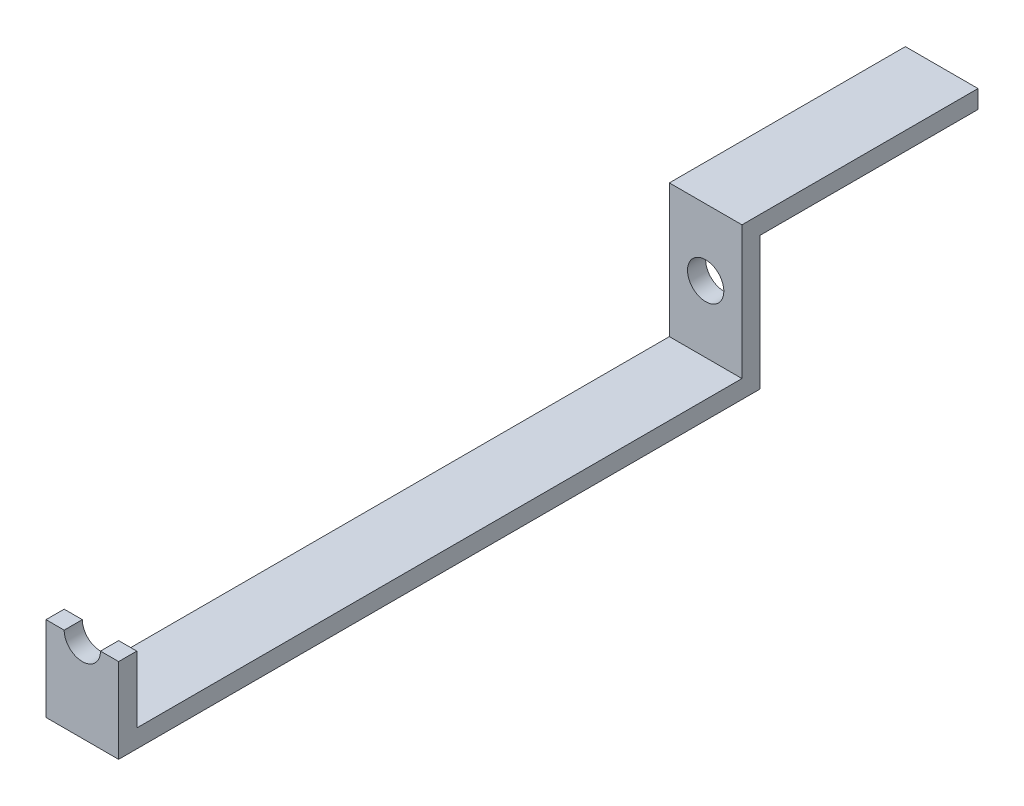
from build123d import *

# Parameters (mm, degrees)
EXTRUDE_1_DEPTH     = 12
CUT_EXTRUDE_1_REACH = 111.567
SKETCH_3_R          = 3


with BuildPart() as part:
    # 草图2 → 凸台-拉伸1 (new body)
    with BuildSketch(Plane(origin=(0, 0, 0), x_dir=(0, 0, -1), z_dir=(1, 0, 0))):
        Polygon((-53, 0), (53, 0), (53, 20), (53, 22), (89, 22), (89, 25), (50, 25), (50, 20), (50, 3), (-50, 3), (-50, 14), (-53, 14), align=None)
    extrude(amount=EXTRUDE_1_DEPTH)

    # 切除-拉伸1: up to this face of the body (flat: up to its plane)
    cut_extrude_1_end = Plane(part.part.faces().sort_by_distance((6, 7, 53))[0])
    # 草图3 → 切除-拉伸1 (cut, up to the picked face)
    with BuildSketch(Plane(origin=(0, 0, -53), x_dir=(-1, 0, 0), z_dir=(0, 0, -1)), mode=Mode.PRIVATE) as cut_extrude_1_sk1:
        with Locations((-6, 14)):
            Circle(SKETCH_3_R)
    cut_extrude_1_tool1 = split(extrude(cut_extrude_1_sk1.sketch, amount=-CUT_EXTRUDE_1_REACH, mode=Mode.PRIVATE), bisect_by=cut_extrude_1_end, keep=Keep.BOTH, mode=Mode.PRIVATE)
    add(cut_extrude_1_tool1.solids().sort_by(Axis((6, 14, -53), (0, 0, 1)))[0], mode=Mode.SUBTRACT)


solid = part.part
